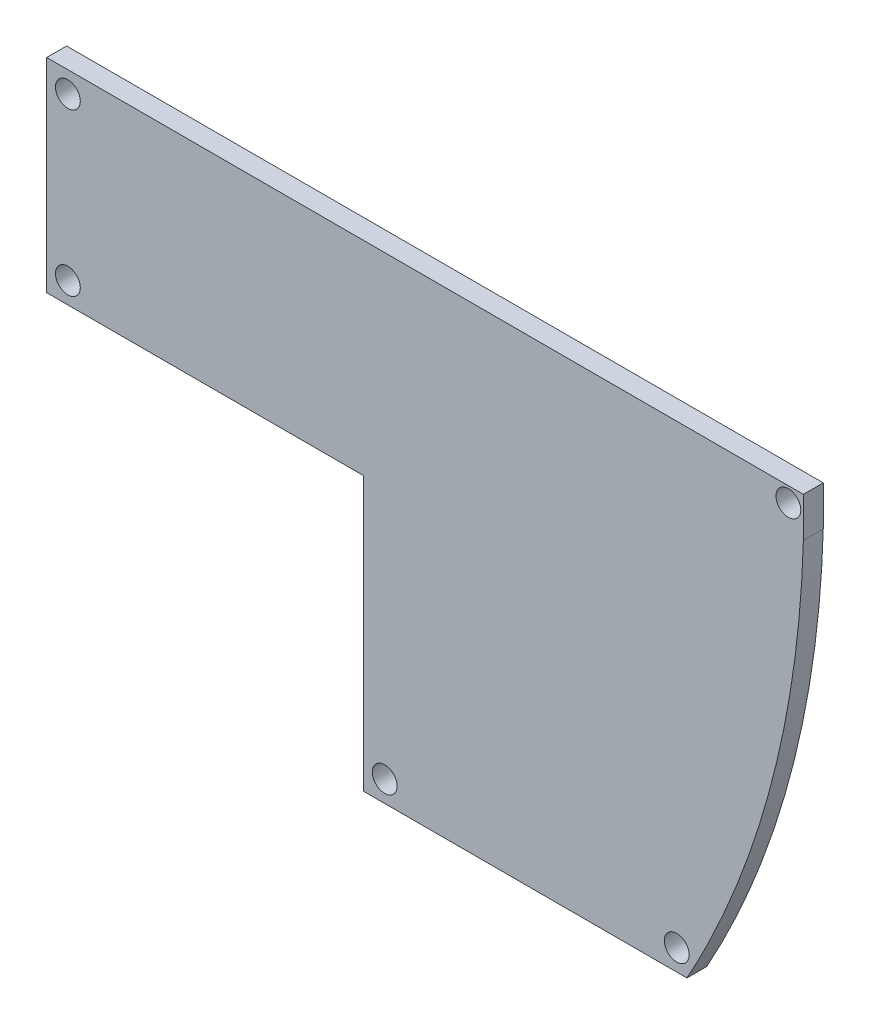
from build123d import *

# Parameters (mm, degrees)
SKETCH_1_R      = 1
EXTRUDE_1_DEPTH = 1.6


with BuildPart() as part:
    # 草图1 → 凸台-拉伸1 (new body)
    with BuildSketch(Plane.XY):
        with BuildLine():
            Line((-87.7, -15.7), (-62.2, -15.7))
            Line((-62.2, -15.7), (-62.2, -37.7))
            Line((-62.2, -37.7), (-36.171688324, -37.7))
            add(Edge.make_bspline(
                [(-36.171688324, -37.7), (-34.684824725, -35.010251168), (-33.36902465, -32.239648029), (-31.086941159, -26.53324039), (-30.129135695, -23.618286004), (-28.96165245, -19.160150204), (-28.618715853, -17.664940446), (-28.023260614, -14.664637138), (-27.770339575, -13.158305121), (-27.140235066, -8.621562635), (-26.891543642, -5.573428708), (-26.8, -2.503618714)],
                knots=[0, 0, 0, 0, 0.25, 0.25, 0.5, 0.5, 0.625, 0.625, 0.75, 0.75, 1, 1, 1, 1], degree=3))
            Line((-26.8, -2.503618714), (-26.8, 0.7))
            Line((-26.8, 0.7), (-87.7, 0.7))
            Line((-87.7, 0.7), (-87.7, -15.7))
        make_face()
        with Locations((-86, -1)):
            Circle(SKETCH_1_R, mode=Mode.SUBTRACT)
        with Locations((-86, -14)):
            Circle(SKETCH_1_R, mode=Mode.SUBTRACT)
        with Locations((-28.008087081, -0.508087081)):
            Circle(SKETCH_1_R, mode=Mode.SUBTRACT)
        with Locations((-36.994977349, -36)):
            Circle(SKETCH_1_R, mode=Mode.SUBTRACT)
        with Locations((-60.5, -36)):
            Circle(SKETCH_1_R, mode=Mode.SUBTRACT)
    extrude(amount=EXTRUDE_1_DEPTH)


solid = part.part
